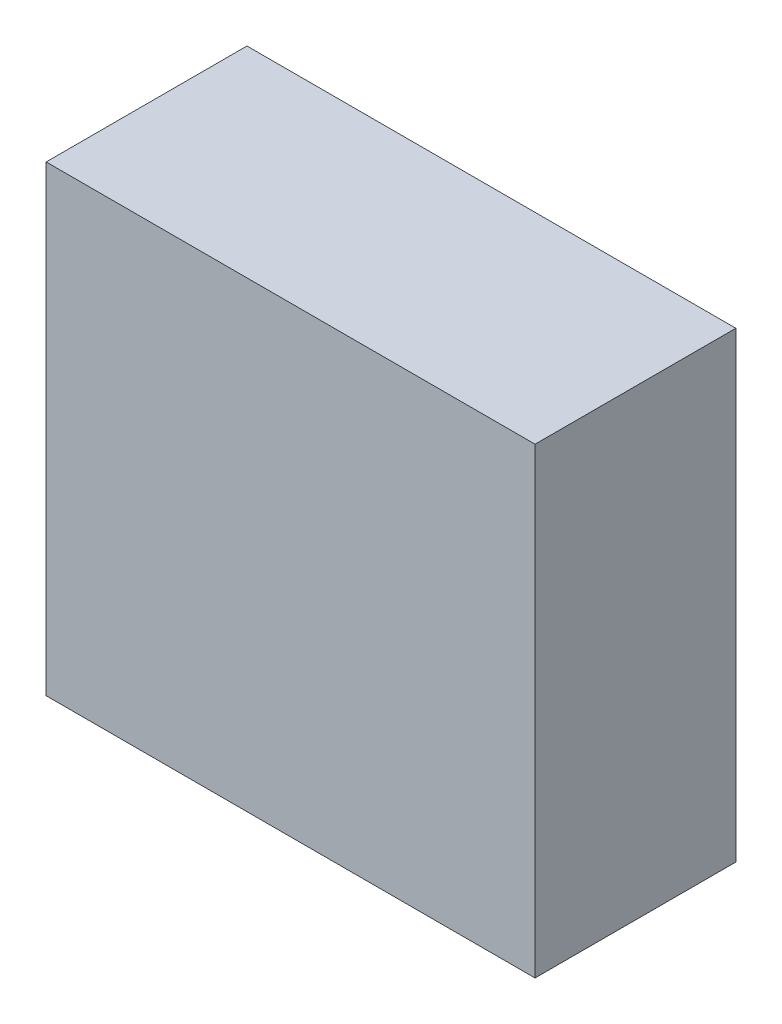
from build123d import *

# Parameters (mm, degrees)
SKETCH1_W      = 42.85
SKETCH1_H      = 40.52
ENVELOPE_DEPTH = 17.6


with BuildPart() as part:
    # Sketch1 → Envelope (new body)
    with BuildSketch(Plane.XY):
        Rectangle(SKETCH1_W, SKETCH1_H)
    extrude(amount=ENVELOPE_DEPTH)


solid = part.part
